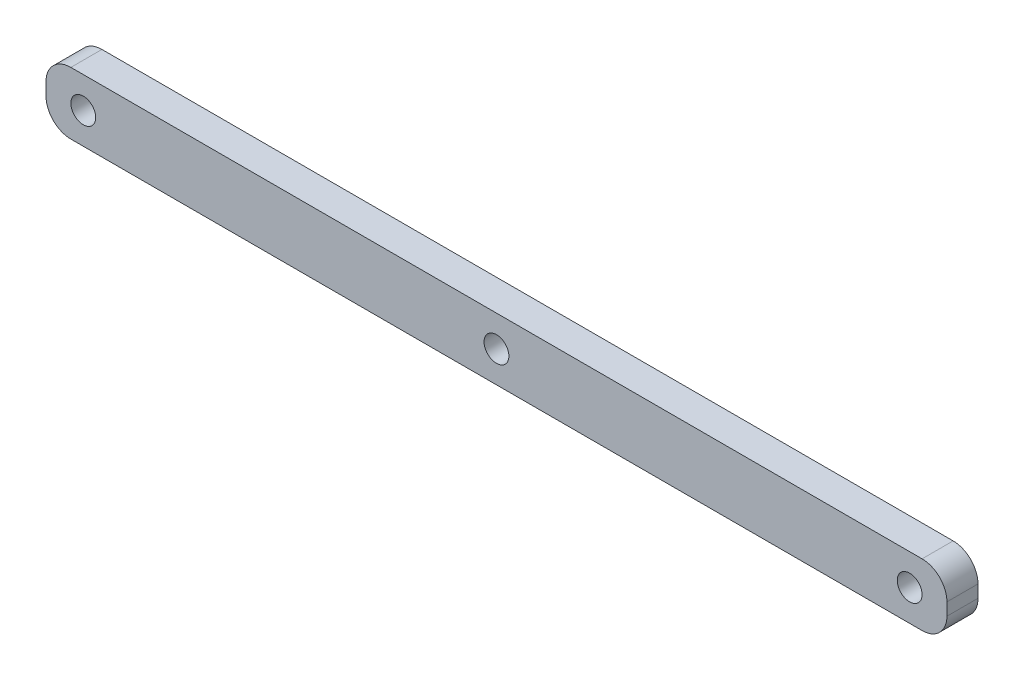
from build123d import *

# Parameters (mm, degrees)
SZKIC1_W                    = 145
SZKIC1_H                    = 10
DODANIE_WYCI_GNI_CIE1_DEPTH = 5
OTWORY_USTALAJ_CE_4_0MM1_D  = 4
ZAOKR_GLENIE1_R             = 4


with BuildPart() as part:
    # Szkic1 → Dodanie-wyciągnięcie1 (new body)
    with BuildSketch(Plane.XY):
        Rectangle(SZKIC1_W, SZKIC1_H)
    extrude(amount=DODANIE_WYCI_GNI_CIE1_DEPTH)

    # Otwory ustalające Ø4.0mm1 (through all)
    with Locations(Plane.XY.offset(5)):
        with Locations((0, 0), (-66.5, 0), (66.5, 0)):
            Hole(OTWORY_USTALAJ_CE_4_0MM1_D / 2)

    # Zaokrąglenie1
    zaokr_glenie1_edges = [part.edges().sort_by_distance(p)[0] for p in [
        (72.5, -5, 2.5),
        (-72.5, -5, 2.5),
        (-72.5, 5, 2.5),
        (72.5, 5, 2.5),
    ]]
    fillet(zaokr_glenie1_edges, radius=ZAOKR_GLENIE1_R)


solid = part.part
